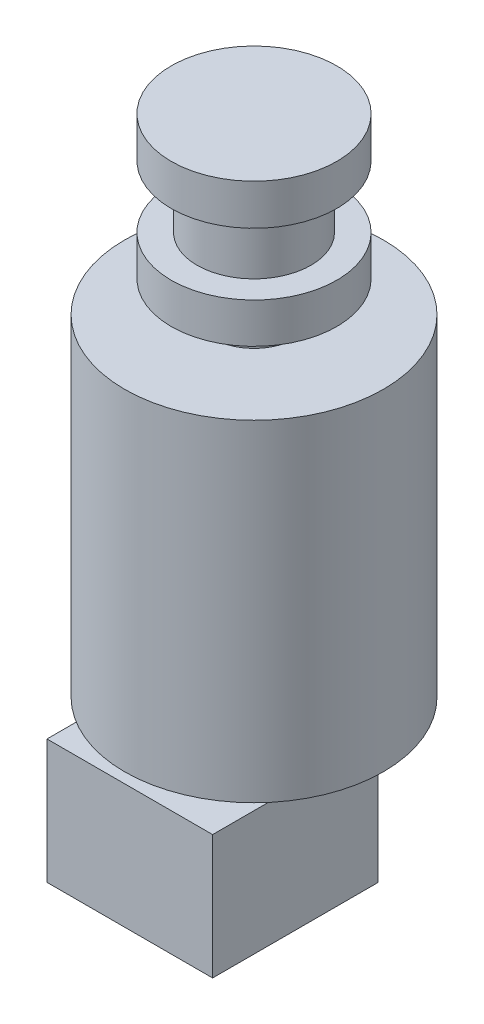
from build123d import *

# Parameters (mm, degrees)
ESBO_O3_W                = 16
ESBO_O3_H                = 16
RESSALTO_EXTRUS_O1_DEPTH = 12
ESBO_O4_R                = 3
RESSALTO_EXTRUS_O2_DEPTH = 6
RESSALTO_EXTRUS_O2_TAPER = 23


with BuildPart() as part:
    # Esboço1 → Revolução1 (revolve)
    with BuildSketch(Plane.XY, mode=Mode.PRIVATE) as revolu_o1_sk:
        Polygon((0, 47.333362218), (8, 47.333362218), (8, 43.391649695), (5.5, 43.391649695), (5.5, 37.391649695), (8, 37.391649695), (8, 33.514974639), (4, 33.514974639), (4, 30.514974639), (12.5, 30.514974639), (12.5, -1.485025361), (2, -1.485025361), (2, -2.985025361), (0, -2.985025361), align=None)
    revolve(revolu_o1_sk.sketch.rotate(Axis((0, 47.333362218, 0), (0, -1, 0)), 90), axis=Axis((0, 47.333362218, 0), (0, -1, 0)))

    # Esboço3 → Ressalto-extrusão1 (add)
    with BuildSketch(Plane.XZ.offset(2.985025361)):
        with Locations((0, 4)):
            Rectangle(ESBO_O3_W, ESBO_O3_H)
    extrude(amount=RESSALTO_EXTRUS_O1_DEPTH)

    # Esboço4 → Ressalto-extrusão2 (add)
    with BuildSketch(Plane.XZ.offset(14.985025361)):
        Circle(ESBO_O4_R)
    extrude(amount=RESSALTO_EXTRUS_O2_DEPTH, taper=RESSALTO_EXTRUS_O2_TAPER)


solid = part.part
